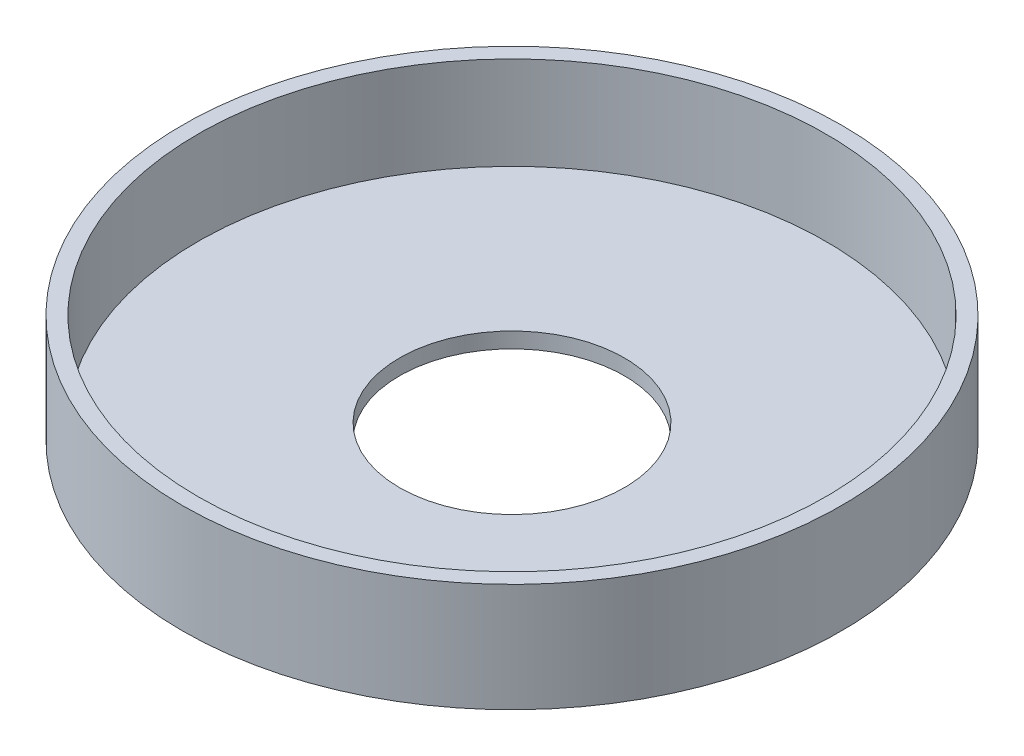
from build123d import *

# Parameters (mm, degrees)
SKETCH1_R           = 42.5
SKETCH1_R_2         = 14.5
BOSS_EXTRUDE1_DEPTH = 2
SKETCH2_R           = 42.5
SKETCH2_R_2         = 40.5
BOSS_EXTRUDE2_DEPTH = 12


with BuildPart() as part:
    # Sketch1 → Boss-Extrude1 (new body)
    with BuildSketch(Plane(origin=(0, 0, 0), x_dir=(1, 0, 0), z_dir=(0, 1, 0))):
        with Locations(Location((0, 0, 0), (0, 0, 270))):
            Circle(SKETCH1_R)
        with Locations(Location((0, 0, 0), (0, 0, 270))):
            Circle(SKETCH1_R_2, mode=Mode.SUBTRACT)
    extrude(amount=BOSS_EXTRUDE1_DEPTH)

    # Sketch2 → Boss-Extrude2 (add)
    with BuildSketch(Plane(origin=(0, 2, 0), x_dir=(1, 0, 0), z_dir=(0, 1, 0))):
        with Locations(Location((0, 0, 0), (0, 0, 270))):
            Circle(SKETCH2_R)
        with Locations(Location((0, 0, 0), (0, 0, 270))):
            Circle(SKETCH2_R_2, mode=Mode.SUBTRACT)
    extrude(amount=BOSS_EXTRUDE2_DEPTH)


solid = part.part
